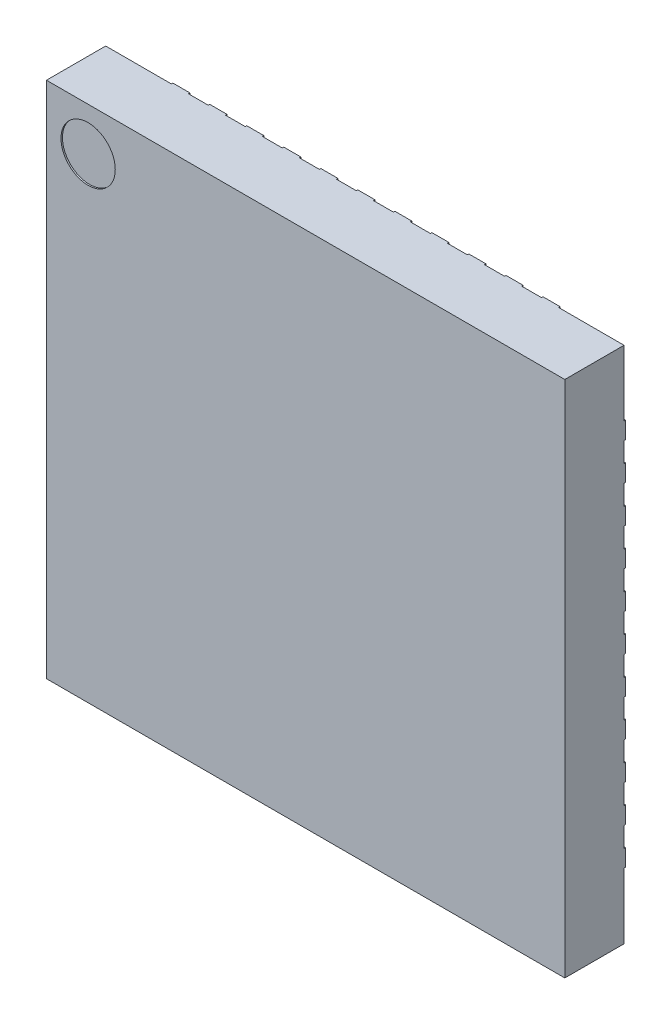
from build123d import *

# Parameters (mm, degrees)
SKETCH1_W                  = 7
SKETCH1_H                  = 7
BOSS_EXTRUDE1_DEPTH        = 0.8
SKETCH2_R                  = 0.36671686
CUT_EXTRUDE1_DEPTH         = 0.02
BOSS_EXTRUDE2_DEPTH        = 0.02
BOSS_EXTRUDE3_DEPTH        = 0.02
LPATTERN1_COUNT            = 6
LPATTERN1_PITCH            = 0.5
LPATTERN1_COUNT_DIR2       = 6
LPATTERN1_PITCH_DIR2       = 0.5
CIRPATTERN1_COPY_1_DEPTH   = 0.02
CIRPATTERN1_COPY_2_DEPTH   = 0.02
CIRPATTERN1_COPY_3_DEPTH   = 0.02
CIRPATTERN1_COPY_4_DEPTH   = 0.02
CIRPATTERN1_COPY_5_DEPTH   = 0.02
CIRPATTERN1_COPY_6_DEPTH   = 0.02
CIRPATTERN1_COPY_7_DEPTH   = 0.02
CIRPATTERN1_COPY_8_DEPTH   = 0.02
CIRPATTERN1_COPY_9_DEPTH   = 0.02
CIRPATTERN1_COPY_10_DEPTH  = 0.02
CIRPATTERN1_COPY_11_DEPTH  = 0.02
CIRPATTERN1_COPY_12_DEPTH  = 0.02
CIRPATTERN1_COPY_13_DEPTH  = 0.02
CIRPATTERN1_COPY_14_DEPTH  = 0.02
CIRPATTERN1_COPY_15_DEPTH  = 0.02
CIRPATTERN1_COPY_16_DEPTH  = 0.02
CIRPATTERN1_COPY_17_DEPTH  = 0.02
CIRPATTERN1_COPY_18_DEPTH  = 0.02
CIRPATTERN1_COPY_19_DEPTH  = 0.02
CIRPATTERN1_COPY_20_DEPTH  = 0.02
CIRPATTERN1_COPY_21_DEPTH  = 0.02
CIRPATTERN1_COPY_22_DEPTH  = 0.02
CIRPATTERN1_COPY_23_DEPTH  = 0.02
CIRPATTERN1_COPY_24_DEPTH  = 0.02
CIRPATTERN1_COPY_25_DEPTH  = 0.02
CIRPATTERN1_COPY_26_DEPTH  = 0.02
CIRPATTERN1_COPY_27_DEPTH  = 0.02
CIRPATTERN1_COPY_28_DEPTH  = 0.02
CIRPATTERN1_COPY_29_DEPTH  = 0.02
CIRPATTERN1_COPY_30_DEPTH  = 0.02
CIRPATTERN1_COPY_31_DEPTH  = 0.02
CIRPATTERN1_COPY_32_DEPTH  = 0.02
CIRPATTERN1_COPY_33_DEPTH  = 0.02
CIRPATTERN1_COPY_34_DEPTH  = 0.02
CIRPATTERN1_COPY_35_DEPTH  = 0.02
CIRPATTERN1_COPY_36_DEPTH  = 0.02
CIRPATTERN1_COPY_37_DEPTH  = 0.02
CIRPATTERN1_COPY_38_DEPTH  = 0.02
CIRPATTERN1_COPY_39_DEPTH  = 0.02
CIRPATTERN1_COPY_40_DEPTH  = 0.02
CIRPATTERN1_COPY_41_DEPTH  = 0.02
CIRPATTERN1_COPY_42_DEPTH  = 0.02
CIRPATTERN1_COPY_43_DEPTH  = 0.02
CIRPATTERN1_COPY_44_DEPTH  = 0.02
CIRPATTERN1_COPY_45_DEPTH  = 0.02
CIRPATTERN1_COPY_46_DEPTH  = 0.02
CIRPATTERN1_COPY_47_DEPTH  = 0.02
CIRPATTERN1_COPY_48_DEPTH  = 0.02
CIRPATTERN1_COPY_49_DEPTH  = 0.02
CIRPATTERN1_COPY_50_DEPTH  = 0.02
CIRPATTERN1_COPY_51_DEPTH  = 0.02
CIRPATTERN1_COPY_52_DEPTH  = 0.02
CIRPATTERN1_COPY_53_DEPTH  = 0.02
CIRPATTERN1_COPY_54_DEPTH  = 0.02
CIRPATTERN1_COPY_55_DEPTH  = 0.02
CIRPATTERN1_COPY_56_DEPTH  = 0.02
CIRPATTERN1_COPY_57_DEPTH  = 0.02
CIRPATTERN1_COPY_58_DEPTH  = 0.02
CIRPATTERN1_COPY_59_DEPTH  = 0.02
CIRPATTERN1_COPY_60_DEPTH  = 0.02
CIRPATTERN1_COPY_61_DEPTH  = 0.02
CIRPATTERN1_COPY_62_DEPTH  = 0.02
CIRPATTERN1_COPY_63_DEPTH  = 0.02
CIRPATTERN1_COPY_64_DEPTH  = 0.02
CIRPATTERN1_COPY_65_DEPTH  = 0.02
CIRPATTERN1_COPY_66_DEPTH  = 0.02
CIRPATTERN1_COPY_67_DEPTH  = 0.02
CIRPATTERN1_COPY_68_DEPTH  = 0.02
CIRPATTERN1_COPY_69_DEPTH  = 0.02
CIRPATTERN1_COPY_70_DEPTH  = 0.02
CIRPATTERN1_COPY_71_DEPTH  = 0.02
CIRPATTERN1_COPY_72_DEPTH  = 0.02
CIRPATTERN1_COPY_73_DEPTH  = 0.02
CIRPATTERN1_COPY_74_DEPTH  = 0.02
CIRPATTERN1_COPY_75_DEPTH  = 0.02
CIRPATTERN1_COPY_76_DEPTH  = 0.02
CIRPATTERN1_COPY_77_DEPTH  = 0.02
CIRPATTERN1_COPY_78_DEPTH  = 0.02
CIRPATTERN1_COPY_79_DEPTH  = 0.02
CIRPATTERN1_COPY_80_DEPTH  = 0.02
CIRPATTERN1_COPY_81_DEPTH  = 0.02
CIRPATTERN1_COPY_82_DEPTH  = 0.02
CIRPATTERN1_COPY_83_DEPTH  = 0.02
CIRPATTERN1_COPY_84_DEPTH  = 0.02
CIRPATTERN1_COPY_85_DEPTH  = 0.02
CIRPATTERN1_COPY_86_DEPTH  = 0.02
CIRPATTERN1_COPY_87_DEPTH  = 0.02
CIRPATTERN1_COPY_88_DEPTH  = 0.02
CIRPATTERN1_COPY_89_DEPTH  = 0.02
CIRPATTERN1_COPY_90_DEPTH  = 0.02
CIRPATTERN1_COPY_91_DEPTH  = 0.02
CIRPATTERN1_COPY_92_DEPTH  = 0.02
CIRPATTERN1_COPY_93_DEPTH  = 0.02
CIRPATTERN1_COPY_94_DEPTH  = 0.02
CIRPATTERN1_COPY_95_DEPTH  = 0.02
CIRPATTERN1_COPY_96_DEPTH  = 0.02
CIRPATTERN1_COPY_97_DEPTH  = 0.02
CIRPATTERN1_COPY_98_DEPTH  = 0.02
CIRPATTERN1_COPY_99_DEPTH  = 0.02
CIRPATTERN1_COPY_100_DEPTH = 0.02
CIRPATTERN1_COPY_101_DEPTH = 0.02
CIRPATTERN1_COPY_102_DEPTH = 0.02
CIRPATTERN1_COPY_103_DEPTH = 0.02
CIRPATTERN1_COPY_104_DEPTH = 0.02
CIRPATTERN1_COPY_105_DEPTH = 0.02
CIRPATTERN1_COPY_106_DEPTH = 0.02
CIRPATTERN1_COPY_107_DEPTH = 0.02
CIRPATTERN1_COPY_108_DEPTH = 0.02


with BuildPart() as part:
    # Sketch1 → Boss-Extrude1 (new body)
    with BuildSketch(Plane.XY):
        Rectangle(SKETCH1_W, SKETCH1_H)
    extrude(amount=BOSS_EXTRUDE1_DEPTH)

    # Sketch2 → Cut-Extrude1 (cut)
    with BuildSketch(Plane.XY.offset(0.8)):
        with Locations((-2.937594595, 2.918449785)):
            Circle(SKETCH2_R)
    extrude(amount=-CUT_EXTRUDE1_DEPTH, mode=Mode.SUBTRACT)

    # Sketch3 → Boss-Extrude2 (add)
    with BuildSketch(Plane(origin=(0, 0, 0), x_dir=(-1, 0, 0), z_dir=(0, 0, -1))):
        Polygon((2, 2.7), (2.7, 2), (2.7, -2.7), (-2.7, -2.7), (-2.7, 2.7), align=None)
    extrude(amount=BOSS_EXTRUDE2_DEPTH)

    # Sketch4 → Boss-Extrude3 (add)
    with BuildSketch(Plane(origin=(0, 0, 0), x_dir=(-1, 0, 0), z_dir=(0, 0, -1))):
        with BuildLine():
            Line((0.115, 3.5), (0.115, 3.115))
            ThreePointArc((0.115, 3.115), (0, 3), (-0.115, 3.115))
            Line((-0.115, 3.115), (-0.115, 3.5))
            Line((-0.115, 3.5), (0, 3.5))
            Line((0, 3.5), (0.115, 3.5))
        make_face()
    boss_extrude3 = extrude(amount=BOSS_EXTRUDE3_DEPTH)

    # LPattern1: Boss-Extrude3 6 × 6
    with Locations(*[Vector(-1, 0, 0) * (i * LPATTERN1_PITCH) + Vector(1, 0, 0) * (j * LPATTERN1_PITCH_DIR2) for i in range(LPATTERN1_COUNT) for j in range(LPATTERN1_COUNT_DIR2) if (i, j) != (0, 0)]):
        add(boss_extrude3)

    # CirPattern1 copy 1 sketch → CirPattern1 copy 1 (add)
    with BuildSketch(Plane(origin=(0, -0.5, 0), x_dir=(0, 1, 0), z_dir=(0, 0, -1))):
        with BuildLine():
            Line((0.115, 3.5), (0.115, 3.115))
            ThreePointArc((0.115, 3.115), (0, 3), (-0.115, 3.115))
            Line((-0.115, 3.115), (-0.115, 3.5))
            Line((-0.115, 3.5), (0, 3.5))
            Line((0, 3.5), (0.115, 3.5))
        make_face()
    extrude(amount=CIRPATTERN1_COPY_1_DEPTH)

    # CirPattern1 copy 2 sketch → CirPattern1 copy 2 (add)
    with BuildSketch(Plane(origin=(-0.5, 0, 0), x_dir=(1, 0, 0), z_dir=(0, 0, -1))):
        with BuildLine():
            Line((0.115, 3.5), (0.115, 3.115))
            ThreePointArc((0.115, 3.115), (0, 3), (-0.115, 3.115))
            Line((-0.115, 3.115), (-0.115, 3.5))
            Line((-0.115, 3.5), (0, 3.5))
            Line((0, 3.5), (0.115, 3.5))
        make_face()
    extrude(amount=CIRPATTERN1_COPY_2_DEPTH)

    # CirPattern1 copy 3 sketch → CirPattern1 copy 3 (add)
    with BuildSketch(Plane(origin=(0, 0.5, 0), x_dir=(0, -1, 0), z_dir=(0, 0, -1))):
        with BuildLine():
            Line((0.115, 3.5), (0.115, 3.115))
            ThreePointArc((0.115, 3.115), (0, 3), (-0.115, 3.115))
            Line((-0.115, 3.115), (-0.115, 3.5))
            Line((-0.115, 3.5), (0, 3.5))
            Line((0, 3.5), (0.115, 3.5))
        make_face()
    extrude(amount=CIRPATTERN1_COPY_3_DEPTH)

    # CirPattern1 copy 4 sketch → CirPattern1 copy 4 (add)
    with BuildSketch(Plane(origin=(0, -1, 0), x_dir=(0, 1, 0), z_dir=(0, 0, -1))):
        with BuildLine():
            Line((0.115, 3.5), (0.115, 3.115))
            ThreePointArc((0.115, 3.115), (0, 3), (-0.115, 3.115))
            Line((-0.115, 3.115), (-0.115, 3.5))
            Line((-0.115, 3.5), (0, 3.5))
            Line((0, 3.5), (0.115, 3.5))
        make_face()
    extrude(amount=CIRPATTERN1_COPY_4_DEPTH)

    # CirPattern1 copy 5 sketch → CirPattern1 copy 5 (add)
    with BuildSketch(Plane(origin=(-1, 0, 0), x_dir=(1, 0, 0), z_dir=(0, 0, -1))):
        with BuildLine():
            Line((0.115, 3.5), (0.115, 3.115))
            ThreePointArc((0.115, 3.115), (0, 3), (-0.115, 3.115))
            Line((-0.115, 3.115), (-0.115, 3.5))
            Line((-0.115, 3.5), (0, 3.5))
            Line((0, 3.5), (0.115, 3.5))
        make_face()
    extrude(amount=CIRPATTERN1_COPY_5_DEPTH)

    # CirPattern1 copy 6 sketch → CirPattern1 copy 6 (add)
    with BuildSketch(Plane(origin=(0, 1, 0), x_dir=(0, -1, 0), z_dir=(0, 0, -1))):
        with BuildLine():
            Line((0.115, 3.5), (0.115, 3.115))
            ThreePointArc((0.115, 3.115), (0, 3), (-0.115, 3.115))
            Line((-0.115, 3.115), (-0.115, 3.5))
            Line((-0.115, 3.5), (0, 3.5))
            Line((0, 3.5), (0.115, 3.5))
        make_face()
    extrude(amount=CIRPATTERN1_COPY_6_DEPTH)

    # CirPattern1 copy 7 sketch → CirPattern1 copy 7 (add)
    with BuildSketch(Plane(origin=(0, -1.5, 0), x_dir=(0, 1, 0), z_dir=(0, 0, -1))):
        with BuildLine():
            Line((0.115, 3.5), (0.115, 3.115))
            ThreePointArc((0.115, 3.115), (0, 3), (-0.115, 3.115))
            Line((-0.115, 3.115), (-0.115, 3.5))
            Line((-0.115, 3.5), (0, 3.5))
            Line((0, 3.5), (0.115, 3.5))
        make_face()
    extrude(amount=CIRPATTERN1_COPY_7_DEPTH)

    # CirPattern1 copy 8 sketch → CirPattern1 copy 8 (add)
    with BuildSketch(Plane(origin=(-1.5, 0, 0), x_dir=(1, 0, 0), z_dir=(0, 0, -1))):
        with BuildLine():
            Line((0.115, 3.5), (0.115, 3.115))
            ThreePointArc((0.115, 3.115), (0, 3), (-0.115, 3.115))
            Line((-0.115, 3.115), (-0.115, 3.5))
            Line((-0.115, 3.5), (0, 3.5))
            Line((0, 3.5), (0.115, 3.5))
        make_face()
    extrude(amount=CIRPATTERN1_COPY_8_DEPTH)

    # CirPattern1 copy 9 sketch → CirPattern1 copy 9 (add)
    with BuildSketch(Plane(origin=(0, 1.5, 0), x_dir=(0, -1, 0), z_dir=(0, 0, -1))):
        with BuildLine():
            Line((0.115, 3.5), (0.115, 3.115))
            ThreePointArc((0.115, 3.115), (0, 3), (-0.115, 3.115))
            Line((-0.115, 3.115), (-0.115, 3.5))
            Line((-0.115, 3.5), (0, 3.5))
            Line((0, 3.5), (0.115, 3.5))
        make_face()
    extrude(amount=CIRPATTERN1_COPY_9_DEPTH)

    # CirPattern1 copy 10 sketch → CirPattern1 copy 10 (add)
    with BuildSketch(Plane(origin=(0, -2, 0), x_dir=(0, 1, 0), z_dir=(0, 0, -1))):
        with BuildLine():
            Line((0.115, 3.5), (0.115, 3.115))
            ThreePointArc((0.115, 3.115), (0, 3), (-0.115, 3.115))
            Line((-0.115, 3.115), (-0.115, 3.5))
            Line((-0.115, 3.5), (0, 3.5))
            Line((0, 3.5), (0.115, 3.5))
        make_face()
    extrude(amount=CIRPATTERN1_COPY_10_DEPTH)

    # CirPattern1 copy 11 sketch → CirPattern1 copy 11 (add)
    with BuildSketch(Plane(origin=(-2, 0, 0), x_dir=(1, 0, 0), z_dir=(0, 0, -1))):
        with BuildLine():
            Line((0.115, 3.5), (0.115, 3.115))
            ThreePointArc((0.115, 3.115), (0, 3), (-0.115, 3.115))
            Line((-0.115, 3.115), (-0.115, 3.5))
            Line((-0.115, 3.5), (0, 3.5))
            Line((0, 3.5), (0.115, 3.5))
        make_face()
    extrude(amount=CIRPATTERN1_COPY_11_DEPTH)

    # CirPattern1 copy 12 sketch → CirPattern1 copy 12 (add)
    with BuildSketch(Plane(origin=(0, 2, 0), x_dir=(0, -1, 0), z_dir=(0, 0, -1))):
        with BuildLine():
            Line((0.115, 3.5), (0.115, 3.115))
            ThreePointArc((0.115, 3.115), (0, 3), (-0.115, 3.115))
            Line((-0.115, 3.115), (-0.115, 3.5))
            Line((-0.115, 3.5), (0, 3.5))
            Line((0, 3.5), (0.115, 3.5))
        make_face()
    extrude(amount=CIRPATTERN1_COPY_12_DEPTH)

    # CirPattern1 copy 13 sketch → CirPattern1 copy 13 (add)
    with BuildSketch(Plane(origin=(0, -2.5, 0), x_dir=(0, 1, 0), z_dir=(0, 0, -1))):
        with BuildLine():
            Line((0.115, 3.5), (0.115, 3.115))
            ThreePointArc((0.115, 3.115), (0, 3), (-0.115, 3.115))
            Line((-0.115, 3.115), (-0.115, 3.5))
            Line((-0.115, 3.5), (0, 3.5))
            Line((0, 3.5), (0.115, 3.5))
        make_face()
    extrude(amount=CIRPATTERN1_COPY_13_DEPTH)

    # CirPattern1 copy 14 sketch → CirPattern1 copy 14 (add)
    with BuildSketch(Plane(origin=(-2.5, 0, 0), x_dir=(1, 0, 0), z_dir=(0, 0, -1))):
        with BuildLine():
            Line((0.115, 3.5), (0.115, 3.115))
            ThreePointArc((0.115, 3.115), (0, 3), (-0.115, 3.115))
            Line((-0.115, 3.115), (-0.115, 3.5))
            Line((-0.115, 3.5), (0, 3.5))
            Line((0, 3.5), (0.115, 3.5))
        make_face()
    extrude(amount=CIRPATTERN1_COPY_14_DEPTH)

    # CirPattern1 copy 15 sketch → CirPattern1 copy 15 (add)
    with BuildSketch(Plane(origin=(0, 2.5, 0), x_dir=(0, -1, 0), z_dir=(0, 0, -1))):
        with BuildLine():
            Line((0.115, 3.5), (0.115, 3.115))
            ThreePointArc((0.115, 3.115), (0, 3), (-0.115, 3.115))
            Line((-0.115, 3.115), (-0.115, 3.5))
            Line((-0.115, 3.5), (0, 3.5))
            Line((0, 3.5), (0.115, 3.5))
        make_face()
    extrude(amount=CIRPATTERN1_COPY_15_DEPTH)

    # CirPattern1 copy 16 sketch → CirPattern1 copy 16 (add)
    with BuildSketch(Plane(origin=(0, 0.5, 0), x_dir=(0, 1, 0), z_dir=(0, 0, -1))):
        with BuildLine():
            Line((0.115, 3.5), (0.115, 3.115))
            ThreePointArc((0.115, 3.115), (0, 3), (-0.115, 3.115))
            Line((-0.115, 3.115), (-0.115, 3.5))
            Line((-0.115, 3.5), (0, 3.5))
            Line((0, 3.5), (0.115, 3.5))
        make_face()
    extrude(amount=CIRPATTERN1_COPY_16_DEPTH)

    # CirPattern1 copy 17 sketch → CirPattern1 copy 17 (add)
    with BuildSketch(Plane(origin=(0.5, 0, 0), x_dir=(1, 0, 0), z_dir=(0, 0, -1))):
        with BuildLine():
            Line((0.115, 3.5), (0.115, 3.115))
            ThreePointArc((0.115, 3.115), (0, 3), (-0.115, 3.115))
            Line((-0.115, 3.115), (-0.115, 3.5))
            Line((-0.115, 3.5), (0, 3.5))
            Line((0, 3.5), (0.115, 3.5))
        make_face()
    extrude(amount=CIRPATTERN1_COPY_17_DEPTH)

    # CirPattern1 copy 18 sketch → CirPattern1 copy 18 (add)
    with BuildSketch(Plane(origin=(0, -0.5, 0), x_dir=(0, -1, 0), z_dir=(0, 0, -1))):
        with BuildLine():
            Line((0.115, 3.5), (0.115, 3.115))
            ThreePointArc((0.115, 3.115), (0, 3), (-0.115, 3.115))
            Line((-0.115, 3.115), (-0.115, 3.5))
            Line((-0.115, 3.5), (0, 3.5))
            Line((0, 3.5), (0.115, 3.5))
        make_face()
    extrude(amount=CIRPATTERN1_COPY_18_DEPTH)

    # CirPattern1 copy 19 sketch → CirPattern1 copy 19 (add)
    with BuildSketch(Plane.YX):
        with BuildLine():
            Line((0.115, 3.5), (0.115, 3.115))
            ThreePointArc((0.115, 3.115), (0, 3), (-0.115, 3.115))
            Line((-0.115, 3.115), (-0.115, 3.5))
            Line((-0.115, 3.5), (0, 3.5))
            Line((0, 3.5), (0.115, 3.5))
        make_face()
    extrude(amount=CIRPATTERN1_COPY_19_DEPTH)

    # CirPattern1 copy 20 sketch → CirPattern1 copy 20 (add)
    with BuildSketch(Plane(origin=(0, 0, 0), x_dir=(1, 0, 0), z_dir=(0, 0, -1))):
        with BuildLine():
            Line((0.115, 3.5), (0.115, 3.115))
            ThreePointArc((0.115, 3.115), (0, 3), (-0.115, 3.115))
            Line((-0.115, 3.115), (-0.115, 3.5))
            Line((-0.115, 3.5), (0, 3.5))
            Line((0, 3.5), (0.115, 3.5))
        make_face()
    extrude(amount=CIRPATTERN1_COPY_20_DEPTH)

    # CirPattern1 copy 21 sketch → CirPattern1 copy 21 (add)
    with BuildSketch(Plane(origin=(0, 0, 0), x_dir=(0, -1, 0), z_dir=(0, 0, -1))):
        with BuildLine():
            Line((0.115, 3.5), (0.115, 3.115))
            ThreePointArc((0.115, 3.115), (0, 3), (-0.115, 3.115))
            Line((-0.115, 3.115), (-0.115, 3.5))
            Line((-0.115, 3.5), (0, 3.5))
            Line((0, 3.5), (0.115, 3.5))
        make_face()
    extrude(amount=CIRPATTERN1_COPY_21_DEPTH)

    # CirPattern1 copy 22 sketch → CirPattern1 copy 22 (add)
    with BuildSketch(Plane(origin=(0, -0.5, 0), x_dir=(0, 1, 0), z_dir=(0, 0, -1))):
        with BuildLine():
            Line((0.115, 3.5), (0.115, 3.115))
            ThreePointArc((0.115, 3.115), (0, 3), (-0.115, 3.115))
            Line((-0.115, 3.115), (-0.115, 3.5))
            Line((-0.115, 3.5), (0, 3.5))
            Line((0, 3.5), (0.115, 3.5))
        make_face()
    extrude(amount=CIRPATTERN1_COPY_22_DEPTH)

    # CirPattern1 copy 23 sketch → CirPattern1 copy 23 (add)
    with BuildSketch(Plane(origin=(-0.5, 0, 0), x_dir=(1, 0, 0), z_dir=(0, 0, -1))):
        with BuildLine():
            Line((0.115, 3.5), (0.115, 3.115))
            ThreePointArc((0.115, 3.115), (0, 3), (-0.115, 3.115))
            Line((-0.115, 3.115), (-0.115, 3.5))
            Line((-0.115, 3.5), (0, 3.5))
            Line((0, 3.5), (0.115, 3.5))
        make_face()
    extrude(amount=CIRPATTERN1_COPY_23_DEPTH)

    # CirPattern1 copy 24 sketch → CirPattern1 copy 24 (add)
    with BuildSketch(Plane(origin=(0, 0.5, 0), x_dir=(0, -1, 0), z_dir=(0, 0, -1))):
        with BuildLine():
            Line((0.115, 3.5), (0.115, 3.115))
            ThreePointArc((0.115, 3.115), (0, 3), (-0.115, 3.115))
            Line((-0.115, 3.115), (-0.115, 3.5))
            Line((-0.115, 3.5), (0, 3.5))
            Line((0, 3.5), (0.115, 3.5))
        make_face()
    extrude(amount=CIRPATTERN1_COPY_24_DEPTH)

    # CirPattern1 copy 25 sketch → CirPattern1 copy 25 (add)
    with BuildSketch(Plane(origin=(0, -1, 0), x_dir=(0, 1, 0), z_dir=(0, 0, -1))):
        with BuildLine():
            Line((0.115, 3.5), (0.115, 3.115))
            ThreePointArc((0.115, 3.115), (0, 3), (-0.115, 3.115))
            Line((-0.115, 3.115), (-0.115, 3.5))
            Line((-0.115, 3.5), (0, 3.5))
            Line((0, 3.5), (0.115, 3.5))
        make_face()
    extrude(amount=CIRPATTERN1_COPY_25_DEPTH)

    # CirPattern1 copy 26 sketch → CirPattern1 copy 26 (add)
    with BuildSketch(Plane(origin=(-1, 0, 0), x_dir=(1, 0, 0), z_dir=(0, 0, -1))):
        with BuildLine():
            Line((0.115, 3.5), (0.115, 3.115))
            ThreePointArc((0.115, 3.115), (0, 3), (-0.115, 3.115))
            Line((-0.115, 3.115), (-0.115, 3.5))
            Line((-0.115, 3.5), (0, 3.5))
            Line((0, 3.5), (0.115, 3.5))
        make_face()
    extrude(amount=CIRPATTERN1_COPY_26_DEPTH)

    # CirPattern1 copy 27 sketch → CirPattern1 copy 27 (add)
    with BuildSketch(Plane(origin=(0, 1, 0), x_dir=(0, -1, 0), z_dir=(0, 0, -1))):
        with BuildLine():
            Line((0.115, 3.5), (0.115, 3.115))
            ThreePointArc((0.115, 3.115), (0, 3), (-0.115, 3.115))
            Line((-0.115, 3.115), (-0.115, 3.5))
            Line((-0.115, 3.5), (0, 3.5))
            Line((0, 3.5), (0.115, 3.5))
        make_face()
    extrude(amount=CIRPATTERN1_COPY_27_DEPTH)

    # CirPattern1 copy 28 sketch → CirPattern1 copy 28 (add)
    with BuildSketch(Plane(origin=(0, -1.5, 0), x_dir=(0, 1, 0), z_dir=(0, 0, -1))):
        with BuildLine():
            Line((0.115, 3.5), (0.115, 3.115))
            ThreePointArc((0.115, 3.115), (0, 3), (-0.115, 3.115))
            Line((-0.115, 3.115), (-0.115, 3.5))
            Line((-0.115, 3.5), (0, 3.5))
            Line((0, 3.5), (0.115, 3.5))
        make_face()
    extrude(amount=CIRPATTERN1_COPY_28_DEPTH)

    # CirPattern1 copy 29 sketch → CirPattern1 copy 29 (add)
    with BuildSketch(Plane(origin=(-1.5, 0, 0), x_dir=(1, 0, 0), z_dir=(0, 0, -1))):
        with BuildLine():
            Line((0.115, 3.5), (0.115, 3.115))
            ThreePointArc((0.115, 3.115), (0, 3), (-0.115, 3.115))
            Line((-0.115, 3.115), (-0.115, 3.5))
            Line((-0.115, 3.5), (0, 3.5))
            Line((0, 3.5), (0.115, 3.5))
        make_face()
    extrude(amount=CIRPATTERN1_COPY_29_DEPTH)

    # CirPattern1 copy 30 sketch → CirPattern1 copy 30 (add)
    with BuildSketch(Plane(origin=(0, 1.5, 0), x_dir=(0, -1, 0), z_dir=(0, 0, -1))):
        with BuildLine():
            Line((0.115, 3.5), (0.115, 3.115))
            ThreePointArc((0.115, 3.115), (0, 3), (-0.115, 3.115))
            Line((-0.115, 3.115), (-0.115, 3.5))
            Line((-0.115, 3.5), (0, 3.5))
            Line((0, 3.5), (0.115, 3.5))
        make_face()
    extrude(amount=CIRPATTERN1_COPY_30_DEPTH)

    # CirPattern1 copy 31 sketch → CirPattern1 copy 31 (add)
    with BuildSketch(Plane(origin=(0, -2, 0), x_dir=(0, 1, 0), z_dir=(0, 0, -1))):
        with BuildLine():
            Line((0.115, 3.5), (0.115, 3.115))
            ThreePointArc((0.115, 3.115), (0, 3), (-0.115, 3.115))
            Line((-0.115, 3.115), (-0.115, 3.5))
            Line((-0.115, 3.5), (0, 3.5))
            Line((0, 3.5), (0.115, 3.5))
        make_face()
    extrude(amount=CIRPATTERN1_COPY_31_DEPTH)

    # CirPattern1 copy 32 sketch → CirPattern1 copy 32 (add)
    with BuildSketch(Plane(origin=(-2, 0, 0), x_dir=(1, 0, 0), z_dir=(0, 0, -1))):
        with BuildLine():
            Line((0.115, 3.5), (0.115, 3.115))
            ThreePointArc((0.115, 3.115), (0, 3), (-0.115, 3.115))
            Line((-0.115, 3.115), (-0.115, 3.5))
            Line((-0.115, 3.5), (0, 3.5))
            Line((0, 3.5), (0.115, 3.5))
        make_face()
    extrude(amount=CIRPATTERN1_COPY_32_DEPTH)

    # CirPattern1 copy 33 sketch → CirPattern1 copy 33 (add)
    with BuildSketch(Plane(origin=(0, 2, 0), x_dir=(0, -1, 0), z_dir=(0, 0, -1))):
        with BuildLine():
            Line((0.115, 3.5), (0.115, 3.115))
            ThreePointArc((0.115, 3.115), (0, 3), (-0.115, 3.115))
            Line((-0.115, 3.115), (-0.115, 3.5))
            Line((-0.115, 3.5), (0, 3.5))
            Line((0, 3.5), (0.115, 3.5))
        make_face()
    extrude(amount=CIRPATTERN1_COPY_33_DEPTH)

    # CirPattern1 copy 34 sketch → CirPattern1 copy 34 (add)
    with BuildSketch(Plane(origin=(0, 1, 0), x_dir=(0, 1, 0), z_dir=(0, 0, -1))):
        with BuildLine():
            Line((0.115, 3.5), (0.115, 3.115))
            ThreePointArc((0.115, 3.115), (0, 3), (-0.115, 3.115))
            Line((-0.115, 3.115), (-0.115, 3.5))
            Line((-0.115, 3.5), (0, 3.5))
            Line((0, 3.5), (0.115, 3.5))
        make_face()
    extrude(amount=CIRPATTERN1_COPY_34_DEPTH)

    # CirPattern1 copy 35 sketch → CirPattern1 copy 35 (add)
    with BuildSketch(Plane(origin=(1, 0, 0), x_dir=(1, 0, 0), z_dir=(0, 0, -1))):
        with BuildLine():
            Line((0.115, 3.5), (0.115, 3.115))
            ThreePointArc((0.115, 3.115), (0, 3), (-0.115, 3.115))
            Line((-0.115, 3.115), (-0.115, 3.5))
            Line((-0.115, 3.5), (0, 3.5))
            Line((0, 3.5), (0.115, 3.5))
        make_face()
    extrude(amount=CIRPATTERN1_COPY_35_DEPTH)

    # CirPattern1 copy 36 sketch → CirPattern1 copy 36 (add)
    with BuildSketch(Plane(origin=(0, -1, 0), x_dir=(0, -1, 0), z_dir=(0, 0, -1))):
        with BuildLine():
            Line((0.115, 3.5), (0.115, 3.115))
            ThreePointArc((0.115, 3.115), (0, 3), (-0.115, 3.115))
            Line((-0.115, 3.115), (-0.115, 3.5))
            Line((-0.115, 3.5), (0, 3.5))
            Line((0, 3.5), (0.115, 3.5))
        make_face()
    extrude(amount=CIRPATTERN1_COPY_36_DEPTH)

    # CirPattern1 copy 37 sketch → CirPattern1 copy 37 (add)
    with BuildSketch(Plane(origin=(0, 0.5, 0), x_dir=(0, 1, 0), z_dir=(0, 0, -1))):
        with BuildLine():
            Line((0.115, 3.5), (0.115, 3.115))
            ThreePointArc((0.115, 3.115), (0, 3), (-0.115, 3.115))
            Line((-0.115, 3.115), (-0.115, 3.5))
            Line((-0.115, 3.5), (0, 3.5))
            Line((0, 3.5), (0.115, 3.5))
        make_face()
    extrude(amount=CIRPATTERN1_COPY_37_DEPTH)

    # CirPattern1 copy 38 sketch → CirPattern1 copy 38 (add)
    with BuildSketch(Plane(origin=(0.5, 0, 0), x_dir=(1, 0, 0), z_dir=(0, 0, -1))):
        with BuildLine():
            Line((0.115, 3.5), (0.115, 3.115))
            ThreePointArc((0.115, 3.115), (0, 3), (-0.115, 3.115))
            Line((-0.115, 3.115), (-0.115, 3.5))
            Line((-0.115, 3.5), (0, 3.5))
            Line((0, 3.5), (0.115, 3.5))
        make_face()
    extrude(amount=CIRPATTERN1_COPY_38_DEPTH)

    # CirPattern1 copy 39 sketch → CirPattern1 copy 39 (add)
    with BuildSketch(Plane(origin=(0, -0.5, 0), x_dir=(0, -1, 0), z_dir=(0, 0, -1))):
        with BuildLine():
            Line((0.115, 3.5), (0.115, 3.115))
            ThreePointArc((0.115, 3.115), (0, 3), (-0.115, 3.115))
            Line((-0.115, 3.115), (-0.115, 3.5))
            Line((-0.115, 3.5), (0, 3.5))
            Line((0, 3.5), (0.115, 3.5))
        make_face()
    extrude(amount=CIRPATTERN1_COPY_39_DEPTH)

    # CirPattern1 copy 40 sketch → CirPattern1 copy 40 (add)
    with BuildSketch(Plane.YX):
        with BuildLine():
            Line((0.115, 3.5), (0.115, 3.115))
            ThreePointArc((0.115, 3.115), (0, 3), (-0.115, 3.115))
            Line((-0.115, 3.115), (-0.115, 3.5))
            Line((-0.115, 3.5), (0, 3.5))
            Line((0, 3.5), (0.115, 3.5))
        make_face()
    extrude(amount=CIRPATTERN1_COPY_40_DEPTH)

    # CirPattern1 copy 41 sketch → CirPattern1 copy 41 (add)
    with BuildSketch(Plane(origin=(0, 0, 0), x_dir=(1, 0, 0), z_dir=(0, 0, -1))):
        with BuildLine():
            Line((0.115, 3.5), (0.115, 3.115))
            ThreePointArc((0.115, 3.115), (0, 3), (-0.115, 3.115))
            Line((-0.115, 3.115), (-0.115, 3.5))
            Line((-0.115, 3.5), (0, 3.5))
            Line((0, 3.5), (0.115, 3.5))
        make_face()
    extrude(amount=CIRPATTERN1_COPY_41_DEPTH)

    # CirPattern1 copy 42 sketch → CirPattern1 copy 42 (add)
    with BuildSketch(Plane(origin=(0, 0, 0), x_dir=(0, -1, 0), z_dir=(0, 0, -1))):
        with BuildLine():
            Line((0.115, 3.5), (0.115, 3.115))
            ThreePointArc((0.115, 3.115), (0, 3), (-0.115, 3.115))
            Line((-0.115, 3.115), (-0.115, 3.5))
            Line((-0.115, 3.5), (0, 3.5))
            Line((0, 3.5), (0.115, 3.5))
        make_face()
    extrude(amount=CIRPATTERN1_COPY_42_DEPTH)

    # CirPattern1 copy 43 sketch → CirPattern1 copy 43 (add)
    with BuildSketch(Plane(origin=(0, -0.5, 0), x_dir=(0, 1, 0), z_dir=(0, 0, -1))):
        with BuildLine():
            Line((0.115, 3.5), (0.115, 3.115))
            ThreePointArc((0.115, 3.115), (0, 3), (-0.115, 3.115))
            Line((-0.115, 3.115), (-0.115, 3.5))
            Line((-0.115, 3.5), (0, 3.5))
            Line((0, 3.5), (0.115, 3.5))
        make_face()
    extrude(amount=CIRPATTERN1_COPY_43_DEPTH)

    # CirPattern1 copy 44 sketch → CirPattern1 copy 44 (add)
    with BuildSketch(Plane(origin=(-0.5, 0, 0), x_dir=(1, 0, 0), z_dir=(0, 0, -1))):
        with BuildLine():
            Line((0.115, 3.5), (0.115, 3.115))
            ThreePointArc((0.115, 3.115), (0, 3), (-0.115, 3.115))
            Line((-0.115, 3.115), (-0.115, 3.5))
            Line((-0.115, 3.5), (0, 3.5))
            Line((0, 3.5), (0.115, 3.5))
        make_face()
    extrude(amount=CIRPATTERN1_COPY_44_DEPTH)

    # CirPattern1 copy 45 sketch → CirPattern1 copy 45 (add)
    with BuildSketch(Plane(origin=(0, 0.5, 0), x_dir=(0, -1, 0), z_dir=(0, 0, -1))):
        with BuildLine():
            Line((0.115, 3.5), (0.115, 3.115))
            ThreePointArc((0.115, 3.115), (0, 3), (-0.115, 3.115))
            Line((-0.115, 3.115), (-0.115, 3.5))
            Line((-0.115, 3.5), (0, 3.5))
            Line((0, 3.5), (0.115, 3.5))
        make_face()
    extrude(amount=CIRPATTERN1_COPY_45_DEPTH)

    # CirPattern1 copy 46 sketch → CirPattern1 copy 46 (add)
    with BuildSketch(Plane(origin=(0, -1, 0), x_dir=(0, 1, 0), z_dir=(0, 0, -1))):
        with BuildLine():
            Line((0.115, 3.5), (0.115, 3.115))
            ThreePointArc((0.115, 3.115), (0, 3), (-0.115, 3.115))
            Line((-0.115, 3.115), (-0.115, 3.5))
            Line((-0.115, 3.5), (0, 3.5))
            Line((0, 3.5), (0.115, 3.5))
        make_face()
    extrude(amount=CIRPATTERN1_COPY_46_DEPTH)

    # CirPattern1 copy 47 sketch → CirPattern1 copy 47 (add)
    with BuildSketch(Plane(origin=(-1, 0, 0), x_dir=(1, 0, 0), z_dir=(0, 0, -1))):
        with BuildLine():
            Line((0.115, 3.5), (0.115, 3.115))
            ThreePointArc((0.115, 3.115), (0, 3), (-0.115, 3.115))
            Line((-0.115, 3.115), (-0.115, 3.5))
            Line((-0.115, 3.5), (0, 3.5))
            Line((0, 3.5), (0.115, 3.5))
        make_face()
    extrude(amount=CIRPATTERN1_COPY_47_DEPTH)

    # CirPattern1 copy 48 sketch → CirPattern1 copy 48 (add)
    with BuildSketch(Plane(origin=(0, 1, 0), x_dir=(0, -1, 0), z_dir=(0, 0, -1))):
        with BuildLine():
            Line((0.115, 3.5), (0.115, 3.115))
            ThreePointArc((0.115, 3.115), (0, 3), (-0.115, 3.115))
            Line((-0.115, 3.115), (-0.115, 3.5))
            Line((-0.115, 3.5), (0, 3.5))
            Line((0, 3.5), (0.115, 3.5))
        make_face()
    extrude(amount=CIRPATTERN1_COPY_48_DEPTH)

    # CirPattern1 copy 49 sketch → CirPattern1 copy 49 (add)
    with BuildSketch(Plane(origin=(0, -1.5, 0), x_dir=(0, 1, 0), z_dir=(0, 0, -1))):
        with BuildLine():
            Line((0.115, 3.5), (0.115, 3.115))
            ThreePointArc((0.115, 3.115), (0, 3), (-0.115, 3.115))
            Line((-0.115, 3.115), (-0.115, 3.5))
            Line((-0.115, 3.5), (0, 3.5))
            Line((0, 3.5), (0.115, 3.5))
        make_face()
    extrude(amount=CIRPATTERN1_COPY_49_DEPTH)

    # CirPattern1 copy 50 sketch → CirPattern1 copy 50 (add)
    with BuildSketch(Plane(origin=(-1.5, 0, 0), x_dir=(1, 0, 0), z_dir=(0, 0, -1))):
        with BuildLine():
            Line((0.115, 3.5), (0.115, 3.115))
            ThreePointArc((0.115, 3.115), (0, 3), (-0.115, 3.115))
            Line((-0.115, 3.115), (-0.115, 3.5))
            Line((-0.115, 3.5), (0, 3.5))
            Line((0, 3.5), (0.115, 3.5))
        make_face()
    extrude(amount=CIRPATTERN1_COPY_50_DEPTH)

    # CirPattern1 copy 51 sketch → CirPattern1 copy 51 (add)
    with BuildSketch(Plane(origin=(0, 1.5, 0), x_dir=(0, -1, 0), z_dir=(0, 0, -1))):
        with BuildLine():
            Line((0.115, 3.5), (0.115, 3.115))
            ThreePointArc((0.115, 3.115), (0, 3), (-0.115, 3.115))
            Line((-0.115, 3.115), (-0.115, 3.5))
            Line((-0.115, 3.5), (0, 3.5))
            Line((0, 3.5), (0.115, 3.5))
        make_face()
    extrude(amount=CIRPATTERN1_COPY_51_DEPTH)

    # CirPattern1 copy 52 sketch → CirPattern1 copy 52 (add)
    with BuildSketch(Plane(origin=(0, 1.5, 0), x_dir=(0, 1, 0), z_dir=(0, 0, -1))):
        with BuildLine():
            Line((0.115, 3.5), (0.115, 3.115))
            ThreePointArc((0.115, 3.115), (0, 3), (-0.115, 3.115))
            Line((-0.115, 3.115), (-0.115, 3.5))
            Line((-0.115, 3.5), (0, 3.5))
            Line((0, 3.5), (0.115, 3.5))
        make_face()
    extrude(amount=CIRPATTERN1_COPY_52_DEPTH)

    # CirPattern1 copy 53 sketch → CirPattern1 copy 53 (add)
    with BuildSketch(Plane(origin=(1.5, 0, 0), x_dir=(1, 0, 0), z_dir=(0, 0, -1))):
        with BuildLine():
            Line((0.115, 3.5), (0.115, 3.115))
            ThreePointArc((0.115, 3.115), (0, 3), (-0.115, 3.115))
            Line((-0.115, 3.115), (-0.115, 3.5))
            Line((-0.115, 3.5), (0, 3.5))
            Line((0, 3.5), (0.115, 3.5))
        make_face()
    extrude(amount=CIRPATTERN1_COPY_53_DEPTH)

    # CirPattern1 copy 54 sketch → CirPattern1 copy 54 (add)
    with BuildSketch(Plane(origin=(0, -1.5, 0), x_dir=(0, -1, 0), z_dir=(0, 0, -1))):
        with BuildLine():
            Line((0.115, 3.5), (0.115, 3.115))
            ThreePointArc((0.115, 3.115), (0, 3), (-0.115, 3.115))
            Line((-0.115, 3.115), (-0.115, 3.5))
            Line((-0.115, 3.5), (0, 3.5))
            Line((0, 3.5), (0.115, 3.5))
        make_face()
    extrude(amount=CIRPATTERN1_COPY_54_DEPTH)

    # CirPattern1 copy 55 sketch → CirPattern1 copy 55 (add)
    with BuildSketch(Plane(origin=(0, 1, 0), x_dir=(0, 1, 0), z_dir=(0, 0, -1))):
        with BuildLine():
            Line((0.115, 3.5), (0.115, 3.115))
            ThreePointArc((0.115, 3.115), (0, 3), (-0.115, 3.115))
            Line((-0.115, 3.115), (-0.115, 3.5))
            Line((-0.115, 3.5), (0, 3.5))
            Line((0, 3.5), (0.115, 3.5))
        make_face()
    extrude(amount=CIRPATTERN1_COPY_55_DEPTH)

    # CirPattern1 copy 56 sketch → CirPattern1 copy 56 (add)
    with BuildSketch(Plane(origin=(1, 0, 0), x_dir=(1, 0, 0), z_dir=(0, 0, -1))):
        with BuildLine():
            Line((0.115, 3.5), (0.115, 3.115))
            ThreePointArc((0.115, 3.115), (0, 3), (-0.115, 3.115))
            Line((-0.115, 3.115), (-0.115, 3.5))
            Line((-0.115, 3.5), (0, 3.5))
            Line((0, 3.5), (0.115, 3.5))
        make_face()
    extrude(amount=CIRPATTERN1_COPY_56_DEPTH)

    # CirPattern1 copy 57 sketch → CirPattern1 copy 57 (add)
    with BuildSketch(Plane(origin=(0, -1, 0), x_dir=(0, -1, 0), z_dir=(0, 0, -1))):
        with BuildLine():
            Line((0.115, 3.5), (0.115, 3.115))
            ThreePointArc((0.115, 3.115), (0, 3), (-0.115, 3.115))
            Line((-0.115, 3.115), (-0.115, 3.5))
            Line((-0.115, 3.5), (0, 3.5))
            Line((0, 3.5), (0.115, 3.5))
        make_face()
    extrude(amount=CIRPATTERN1_COPY_57_DEPTH)

    # CirPattern1 copy 58 sketch → CirPattern1 copy 58 (add)
    with BuildSketch(Plane(origin=(0, 0.5, 0), x_dir=(0, 1, 0), z_dir=(0, 0, -1))):
        with BuildLine():
            Line((0.115, 3.5), (0.115, 3.115))
            ThreePointArc((0.115, 3.115), (0, 3), (-0.115, 3.115))
            Line((-0.115, 3.115), (-0.115, 3.5))
            Line((-0.115, 3.5), (0, 3.5))
            Line((0, 3.5), (0.115, 3.5))
        make_face()
    extrude(amount=CIRPATTERN1_COPY_58_DEPTH)

    # CirPattern1 copy 59 sketch → CirPattern1 copy 59 (add)
    with BuildSketch(Plane(origin=(0.5, 0, 0), x_dir=(1, 0, 0), z_dir=(0, 0, -1))):
        with BuildLine():
            Line((0.115, 3.5), (0.115, 3.115))
            ThreePointArc((0.115, 3.115), (0, 3), (-0.115, 3.115))
            Line((-0.115, 3.115), (-0.115, 3.5))
            Line((-0.115, 3.5), (0, 3.5))
            Line((0, 3.5), (0.115, 3.5))
        make_face()
    extrude(amount=CIRPATTERN1_COPY_59_DEPTH)

    # CirPattern1 copy 60 sketch → CirPattern1 copy 60 (add)
    with BuildSketch(Plane(origin=(0, -0.5, 0), x_dir=(0, -1, 0), z_dir=(0, 0, -1))):
        with BuildLine():
            Line((0.115, 3.5), (0.115, 3.115))
            ThreePointArc((0.115, 3.115), (0, 3), (-0.115, 3.115))
            Line((-0.115, 3.115), (-0.115, 3.5))
            Line((-0.115, 3.5), (0, 3.5))
            Line((0, 3.5), (0.115, 3.5))
        make_face()
    extrude(amount=CIRPATTERN1_COPY_60_DEPTH)

    # CirPattern1 copy 61 sketch → CirPattern1 copy 61 (add)
    with BuildSketch(Plane.YX):
        with BuildLine():
            Line((0.115, 3.5), (0.115, 3.115))
            ThreePointArc((0.115, 3.115), (0, 3), (-0.115, 3.115))
            Line((-0.115, 3.115), (-0.115, 3.5))
            Line((-0.115, 3.5), (0, 3.5))
            Line((0, 3.5), (0.115, 3.5))
        make_face()
    extrude(amount=CIRPATTERN1_COPY_61_DEPTH)

    # CirPattern1 copy 62 sketch → CirPattern1 copy 62 (add)
    with BuildSketch(Plane(origin=(0, 0, 0), x_dir=(1, 0, 0), z_dir=(0, 0, -1))):
        with BuildLine():
            Line((0.115, 3.5), (0.115, 3.115))
            ThreePointArc((0.115, 3.115), (0, 3), (-0.115, 3.115))
            Line((-0.115, 3.115), (-0.115, 3.5))
            Line((-0.115, 3.5), (0, 3.5))
            Line((0, 3.5), (0.115, 3.5))
        make_face()
    extrude(amount=CIRPATTERN1_COPY_62_DEPTH)

    # CirPattern1 copy 63 sketch → CirPattern1 copy 63 (add)
    with BuildSketch(Plane(origin=(0, 0, 0), x_dir=(0, -1, 0), z_dir=(0, 0, -1))):
        with BuildLine():
            Line((0.115, 3.5), (0.115, 3.115))
            ThreePointArc((0.115, 3.115), (0, 3), (-0.115, 3.115))
            Line((-0.115, 3.115), (-0.115, 3.5))
            Line((-0.115, 3.5), (0, 3.5))
            Line((0, 3.5), (0.115, 3.5))
        make_face()
    extrude(amount=CIRPATTERN1_COPY_63_DEPTH)

    # CirPattern1 copy 64 sketch → CirPattern1 copy 64 (add)
    with BuildSketch(Plane(origin=(0, -0.5, 0), x_dir=(0, 1, 0), z_dir=(0, 0, -1))):
        with BuildLine():
            Line((0.115, 3.5), (0.115, 3.115))
            ThreePointArc((0.115, 3.115), (0, 3), (-0.115, 3.115))
            Line((-0.115, 3.115), (-0.115, 3.5))
            Line((-0.115, 3.5), (0, 3.5))
            Line((0, 3.5), (0.115, 3.5))
        make_face()
    extrude(amount=CIRPATTERN1_COPY_64_DEPTH)

    # CirPattern1 copy 65 sketch → CirPattern1 copy 65 (add)
    with BuildSketch(Plane(origin=(-0.5, 0, 0), x_dir=(1, 0, 0), z_dir=(0, 0, -1))):
        with BuildLine():
            Line((0.115, 3.5), (0.115, 3.115))
            ThreePointArc((0.115, 3.115), (0, 3), (-0.115, 3.115))
            Line((-0.115, 3.115), (-0.115, 3.5))
            Line((-0.115, 3.5), (0, 3.5))
            Line((0, 3.5), (0.115, 3.5))
        make_face()
    extrude(amount=CIRPATTERN1_COPY_65_DEPTH)

    # CirPattern1 copy 66 sketch → CirPattern1 copy 66 (add)
    with BuildSketch(Plane(origin=(0, 0.5, 0), x_dir=(0, -1, 0), z_dir=(0, 0, -1))):
        with BuildLine():
            Line((0.115, 3.5), (0.115, 3.115))
            ThreePointArc((0.115, 3.115), (0, 3), (-0.115, 3.115))
            Line((-0.115, 3.115), (-0.115, 3.5))
            Line((-0.115, 3.5), (0, 3.5))
            Line((0, 3.5), (0.115, 3.5))
        make_face()
    extrude(amount=CIRPATTERN1_COPY_66_DEPTH)

    # CirPattern1 copy 67 sketch → CirPattern1 copy 67 (add)
    with BuildSketch(Plane(origin=(0, -1, 0), x_dir=(0, 1, 0), z_dir=(0, 0, -1))):
        with BuildLine():
            Line((0.115, 3.5), (0.115, 3.115))
            ThreePointArc((0.115, 3.115), (0, 3), (-0.115, 3.115))
            Line((-0.115, 3.115), (-0.115, 3.5))
            Line((-0.115, 3.5), (0, 3.5))
            Line((0, 3.5), (0.115, 3.5))
        make_face()
    extrude(amount=CIRPATTERN1_COPY_67_DEPTH)

    # CirPattern1 copy 68 sketch → CirPattern1 copy 68 (add)
    with BuildSketch(Plane(origin=(-1, 0, 0), x_dir=(1, 0, 0), z_dir=(0, 0, -1))):
        with BuildLine():
            Line((0.115, 3.5), (0.115, 3.115))
            ThreePointArc((0.115, 3.115), (0, 3), (-0.115, 3.115))
            Line((-0.115, 3.115), (-0.115, 3.5))
            Line((-0.115, 3.5), (0, 3.5))
            Line((0, 3.5), (0.115, 3.5))
        make_face()
    extrude(amount=CIRPATTERN1_COPY_68_DEPTH)

    # CirPattern1 copy 69 sketch → CirPattern1 copy 69 (add)
    with BuildSketch(Plane(origin=(0, 1, 0), x_dir=(0, -1, 0), z_dir=(0, 0, -1))):
        with BuildLine():
            Line((0.115, 3.5), (0.115, 3.115))
            ThreePointArc((0.115, 3.115), (0, 3), (-0.115, 3.115))
            Line((-0.115, 3.115), (-0.115, 3.5))
            Line((-0.115, 3.5), (0, 3.5))
            Line((0, 3.5), (0.115, 3.5))
        make_face()
    extrude(amount=CIRPATTERN1_COPY_69_DEPTH)

    # CirPattern1 copy 70 sketch → CirPattern1 copy 70 (add)
    with BuildSketch(Plane(origin=(0, 2, 0), x_dir=(0, 1, 0), z_dir=(0, 0, -1))):
        with BuildLine():
            Line((0.115, 3.5), (0.115, 3.115))
            ThreePointArc((0.115, 3.115), (0, 3), (-0.115, 3.115))
            Line((-0.115, 3.115), (-0.115, 3.5))
            Line((-0.115, 3.5), (0, 3.5))
            Line((0, 3.5), (0.115, 3.5))
        make_face()
    extrude(amount=CIRPATTERN1_COPY_70_DEPTH)

    # CirPattern1 copy 71 sketch → CirPattern1 copy 71 (add)
    with BuildSketch(Plane(origin=(2, 0, 0), x_dir=(1, 0, 0), z_dir=(0, 0, -1))):
        with BuildLine():
            Line((0.115, 3.5), (0.115, 3.115))
            ThreePointArc((0.115, 3.115), (0, 3), (-0.115, 3.115))
            Line((-0.115, 3.115), (-0.115, 3.5))
            Line((-0.115, 3.5), (0, 3.5))
            Line((0, 3.5), (0.115, 3.5))
        make_face()
    extrude(amount=CIRPATTERN1_COPY_71_DEPTH)

    # CirPattern1 copy 72 sketch → CirPattern1 copy 72 (add)
    with BuildSketch(Plane(origin=(0, -2, 0), x_dir=(0, -1, 0), z_dir=(0, 0, -1))):
        with BuildLine():
            Line((0.115, 3.5), (0.115, 3.115))
            ThreePointArc((0.115, 3.115), (0, 3), (-0.115, 3.115))
            Line((-0.115, 3.115), (-0.115, 3.5))
            Line((-0.115, 3.5), (0, 3.5))
            Line((0, 3.5), (0.115, 3.5))
        make_face()
    extrude(amount=CIRPATTERN1_COPY_72_DEPTH)

    # CirPattern1 copy 73 sketch → CirPattern1 copy 73 (add)
    with BuildSketch(Plane(origin=(0, 1.5, 0), x_dir=(0, 1, 0), z_dir=(0, 0, -1))):
        with BuildLine():
            Line((0.115, 3.5), (0.115, 3.115))
            ThreePointArc((0.115, 3.115), (0, 3), (-0.115, 3.115))
            Line((-0.115, 3.115), (-0.115, 3.5))
            Line((-0.115, 3.5), (0, 3.5))
            Line((0, 3.5), (0.115, 3.5))
        make_face()
    extrude(amount=CIRPATTERN1_COPY_73_DEPTH)

    # CirPattern1 copy 74 sketch → CirPattern1 copy 74 (add)
    with BuildSketch(Plane(origin=(1.5, 0, 0), x_dir=(1, 0, 0), z_dir=(0, 0, -1))):
        with BuildLine():
            Line((0.115, 3.5), (0.115, 3.115))
            ThreePointArc((0.115, 3.115), (0, 3), (-0.115, 3.115))
            Line((-0.115, 3.115), (-0.115, 3.5))
            Line((-0.115, 3.5), (0, 3.5))
            Line((0, 3.5), (0.115, 3.5))
        make_face()
    extrude(amount=CIRPATTERN1_COPY_74_DEPTH)

    # CirPattern1 copy 75 sketch → CirPattern1 copy 75 (add)
    with BuildSketch(Plane(origin=(0, -1.5, 0), x_dir=(0, -1, 0), z_dir=(0, 0, -1))):
        with BuildLine():
            Line((0.115, 3.5), (0.115, 3.115))
            ThreePointArc((0.115, 3.115), (0, 3), (-0.115, 3.115))
            Line((-0.115, 3.115), (-0.115, 3.5))
            Line((-0.115, 3.5), (0, 3.5))
            Line((0, 3.5), (0.115, 3.5))
        make_face()
    extrude(amount=CIRPATTERN1_COPY_75_DEPTH)

    # CirPattern1 copy 76 sketch → CirPattern1 copy 76 (add)
    with BuildSketch(Plane(origin=(0, 1, 0), x_dir=(0, 1, 0), z_dir=(0, 0, -1))):
        with BuildLine():
            Line((0.115, 3.5), (0.115, 3.115))
            ThreePointArc((0.115, 3.115), (0, 3), (-0.115, 3.115))
            Line((-0.115, 3.115), (-0.115, 3.5))
            Line((-0.115, 3.5), (0, 3.5))
            Line((0, 3.5), (0.115, 3.5))
        make_face()
    extrude(amount=CIRPATTERN1_COPY_76_DEPTH)

    # CirPattern1 copy 77 sketch → CirPattern1 copy 77 (add)
    with BuildSketch(Plane(origin=(1, 0, 0), x_dir=(1, 0, 0), z_dir=(0, 0, -1))):
        with BuildLine():
            Line((0.115, 3.5), (0.115, 3.115))
            ThreePointArc((0.115, 3.115), (0, 3), (-0.115, 3.115))
            Line((-0.115, 3.115), (-0.115, 3.5))
            Line((-0.115, 3.5), (0, 3.5))
            Line((0, 3.5), (0.115, 3.5))
        make_face()
    extrude(amount=CIRPATTERN1_COPY_77_DEPTH)

    # CirPattern1 copy 78 sketch → CirPattern1 copy 78 (add)
    with BuildSketch(Plane(origin=(0, -1, 0), x_dir=(0, -1, 0), z_dir=(0, 0, -1))):
        with BuildLine():
            Line((0.115, 3.5), (0.115, 3.115))
            ThreePointArc((0.115, 3.115), (0, 3), (-0.115, 3.115))
            Line((-0.115, 3.115), (-0.115, 3.5))
            Line((-0.115, 3.5), (0, 3.5))
            Line((0, 3.5), (0.115, 3.5))
        make_face()
    extrude(amount=CIRPATTERN1_COPY_78_DEPTH)

    # CirPattern1 copy 79 sketch → CirPattern1 copy 79 (add)
    with BuildSketch(Plane(origin=(0, 0.5, 0), x_dir=(0, 1, 0), z_dir=(0, 0, -1))):
        with BuildLine():
            Line((0.115, 3.5), (0.115, 3.115))
            ThreePointArc((0.115, 3.115), (0, 3), (-0.115, 3.115))
            Line((-0.115, 3.115), (-0.115, 3.5))
            Line((-0.115, 3.5), (0, 3.5))
            Line((0, 3.5), (0.115, 3.5))
        make_face()
    extrude(amount=CIRPATTERN1_COPY_79_DEPTH)

    # CirPattern1 copy 80 sketch → CirPattern1 copy 80 (add)
    with BuildSketch(Plane(origin=(0.5, 0, 0), x_dir=(1, 0, 0), z_dir=(0, 0, -1))):
        with BuildLine():
            Line((0.115, 3.5), (0.115, 3.115))
            ThreePointArc((0.115, 3.115), (0, 3), (-0.115, 3.115))
            Line((-0.115, 3.115), (-0.115, 3.5))
            Line((-0.115, 3.5), (0, 3.5))
            Line((0, 3.5), (0.115, 3.5))
        make_face()
    extrude(amount=CIRPATTERN1_COPY_80_DEPTH)

    # CirPattern1 copy 81 sketch → CirPattern1 copy 81 (add)
    with BuildSketch(Plane(origin=(0, -0.5, 0), x_dir=(0, -1, 0), z_dir=(0, 0, -1))):
        with BuildLine():
            Line((0.115, 3.5), (0.115, 3.115))
            ThreePointArc((0.115, 3.115), (0, 3), (-0.115, 3.115))
            Line((-0.115, 3.115), (-0.115, 3.5))
            Line((-0.115, 3.5), (0, 3.5))
            Line((0, 3.5), (0.115, 3.5))
        make_face()
    extrude(amount=CIRPATTERN1_COPY_81_DEPTH)

    # CirPattern1 copy 82 sketch → CirPattern1 copy 82 (add)
    with BuildSketch(Plane.YX):
        with BuildLine():
            Line((0.115, 3.5), (0.115, 3.115))
            ThreePointArc((0.115, 3.115), (0, 3), (-0.115, 3.115))
            Line((-0.115, 3.115), (-0.115, 3.5))
            Line((-0.115, 3.5), (0, 3.5))
            Line((0, 3.5), (0.115, 3.5))
        make_face()
    extrude(amount=CIRPATTERN1_COPY_82_DEPTH)

    # CirPattern1 copy 83 sketch → CirPattern1 copy 83 (add)
    with BuildSketch(Plane(origin=(0, 0, 0), x_dir=(1, 0, 0), z_dir=(0, 0, -1))):
        with BuildLine():
            Line((0.115, 3.5), (0.115, 3.115))
            ThreePointArc((0.115, 3.115), (0, 3), (-0.115, 3.115))
            Line((-0.115, 3.115), (-0.115, 3.5))
            Line((-0.115, 3.5), (0, 3.5))
            Line((0, 3.5), (0.115, 3.5))
        make_face()
    extrude(amount=CIRPATTERN1_COPY_83_DEPTH)

    # CirPattern1 copy 84 sketch → CirPattern1 copy 84 (add)
    with BuildSketch(Plane(origin=(0, 0, 0), x_dir=(0, -1, 0), z_dir=(0, 0, -1))):
        with BuildLine():
            Line((0.115, 3.5), (0.115, 3.115))
            ThreePointArc((0.115, 3.115), (0, 3), (-0.115, 3.115))
            Line((-0.115, 3.115), (-0.115, 3.5))
            Line((-0.115, 3.5), (0, 3.5))
            Line((0, 3.5), (0.115, 3.5))
        make_face()
    extrude(amount=CIRPATTERN1_COPY_84_DEPTH)

    # CirPattern1 copy 85 sketch → CirPattern1 copy 85 (add)
    with BuildSketch(Plane(origin=(0, -0.5, 0), x_dir=(0, 1, 0), z_dir=(0, 0, -1))):
        with BuildLine():
            Line((0.115, 3.5), (0.115, 3.115))
            ThreePointArc((0.115, 3.115), (0, 3), (-0.115, 3.115))
            Line((-0.115, 3.115), (-0.115, 3.5))
            Line((-0.115, 3.5), (0, 3.5))
            Line((0, 3.5), (0.115, 3.5))
        make_face()
    extrude(amount=CIRPATTERN1_COPY_85_DEPTH)

    # CirPattern1 copy 86 sketch → CirPattern1 copy 86 (add)
    with BuildSketch(Plane(origin=(-0.5, 0, 0), x_dir=(1, 0, 0), z_dir=(0, 0, -1))):
        with BuildLine():
            Line((0.115, 3.5), (0.115, 3.115))
            ThreePointArc((0.115, 3.115), (0, 3), (-0.115, 3.115))
            Line((-0.115, 3.115), (-0.115, 3.5))
            Line((-0.115, 3.5), (0, 3.5))
            Line((0, 3.5), (0.115, 3.5))
        make_face()
    extrude(amount=CIRPATTERN1_COPY_86_DEPTH)

    # CirPattern1 copy 87 sketch → CirPattern1 copy 87 (add)
    with BuildSketch(Plane(origin=(0, 0.5, 0), x_dir=(0, -1, 0), z_dir=(0, 0, -1))):
        with BuildLine():
            Line((0.115, 3.5), (0.115, 3.115))
            ThreePointArc((0.115, 3.115), (0, 3), (-0.115, 3.115))
            Line((-0.115, 3.115), (-0.115, 3.5))
            Line((-0.115, 3.5), (0, 3.5))
            Line((0, 3.5), (0.115, 3.5))
        make_face()
    extrude(amount=CIRPATTERN1_COPY_87_DEPTH)

    # CirPattern1 copy 88 sketch → CirPattern1 copy 88 (add)
    with BuildSketch(Plane(origin=(0, 2.5, 0), x_dir=(0, 1, 0), z_dir=(0, 0, -1))):
        with BuildLine():
            Line((0.115, 3.5), (0.115, 3.115))
            ThreePointArc((0.115, 3.115), (0, 3), (-0.115, 3.115))
            Line((-0.115, 3.115), (-0.115, 3.5))
            Line((-0.115, 3.5), (0, 3.5))
            Line((0, 3.5), (0.115, 3.5))
        make_face()
    extrude(amount=CIRPATTERN1_COPY_88_DEPTH)

    # CirPattern1 copy 89 sketch → CirPattern1 copy 89 (add)
    with BuildSketch(Plane(origin=(2.5, 0, 0), x_dir=(1, 0, 0), z_dir=(0, 0, -1))):
        with BuildLine():
            Line((0.115, 3.5), (0.115, 3.115))
            ThreePointArc((0.115, 3.115), (0, 3), (-0.115, 3.115))
            Line((-0.115, 3.115), (-0.115, 3.5))
            Line((-0.115, 3.5), (0, 3.5))
            Line((0, 3.5), (0.115, 3.5))
        make_face()
    extrude(amount=CIRPATTERN1_COPY_89_DEPTH)

    # CirPattern1 copy 90 sketch → CirPattern1 copy 90 (add)
    with BuildSketch(Plane(origin=(0, -2.5, 0), x_dir=(0, -1, 0), z_dir=(0, 0, -1))):
        with BuildLine():
            Line((0.115, 3.5), (0.115, 3.115))
            ThreePointArc((0.115, 3.115), (0, 3), (-0.115, 3.115))
            Line((-0.115, 3.115), (-0.115, 3.5))
            Line((-0.115, 3.5), (0, 3.5))
            Line((0, 3.5), (0.115, 3.5))
        make_face()
    extrude(amount=CIRPATTERN1_COPY_90_DEPTH)

    # CirPattern1 copy 91 sketch → CirPattern1 copy 91 (add)
    with BuildSketch(Plane(origin=(0, 2, 0), x_dir=(0, 1, 0), z_dir=(0, 0, -1))):
        with BuildLine():
            Line((0.115, 3.5), (0.115, 3.115))
            ThreePointArc((0.115, 3.115), (0, 3), (-0.115, 3.115))
            Line((-0.115, 3.115), (-0.115, 3.5))
            Line((-0.115, 3.5), (0, 3.5))
            Line((0, 3.5), (0.115, 3.5))
        make_face()
    extrude(amount=CIRPATTERN1_COPY_91_DEPTH)

    # CirPattern1 copy 92 sketch → CirPattern1 copy 92 (add)
    with BuildSketch(Plane(origin=(2, 0, 0), x_dir=(1, 0, 0), z_dir=(0, 0, -1))):
        with BuildLine():
            Line((0.115, 3.5), (0.115, 3.115))
            ThreePointArc((0.115, 3.115), (0, 3), (-0.115, 3.115))
            Line((-0.115, 3.115), (-0.115, 3.5))
            Line((-0.115, 3.5), (0, 3.5))
            Line((0, 3.5), (0.115, 3.5))
        make_face()
    extrude(amount=CIRPATTERN1_COPY_92_DEPTH)

    # CirPattern1 copy 93 sketch → CirPattern1 copy 93 (add)
    with BuildSketch(Plane(origin=(0, -2, 0), x_dir=(0, -1, 0), z_dir=(0, 0, -1))):
        with BuildLine():
            Line((0.115, 3.5), (0.115, 3.115))
            ThreePointArc((0.115, 3.115), (0, 3), (-0.115, 3.115))
            Line((-0.115, 3.115), (-0.115, 3.5))
            Line((-0.115, 3.5), (0, 3.5))
            Line((0, 3.5), (0.115, 3.5))
        make_face()
    extrude(amount=CIRPATTERN1_COPY_93_DEPTH)

    # CirPattern1 copy 94 sketch → CirPattern1 copy 94 (add)
    with BuildSketch(Plane(origin=(0, 1.5, 0), x_dir=(0, 1, 0), z_dir=(0, 0, -1))):
        with BuildLine():
            Line((0.115, 3.5), (0.115, 3.115))
            ThreePointArc((0.115, 3.115), (0, 3), (-0.115, 3.115))
            Line((-0.115, 3.115), (-0.115, 3.5))
            Line((-0.115, 3.5), (0, 3.5))
            Line((0, 3.5), (0.115, 3.5))
        make_face()
    extrude(amount=CIRPATTERN1_COPY_94_DEPTH)

    # CirPattern1 copy 95 sketch → CirPattern1 copy 95 (add)
    with BuildSketch(Plane(origin=(1.5, 0, 0), x_dir=(1, 0, 0), z_dir=(0, 0, -1))):
        with BuildLine():
            Line((0.115, 3.5), (0.115, 3.115))
            ThreePointArc((0.115, 3.115), (0, 3), (-0.115, 3.115))
            Line((-0.115, 3.115), (-0.115, 3.5))
            Line((-0.115, 3.5), (0, 3.5))
            Line((0, 3.5), (0.115, 3.5))
        make_face()
    extrude(amount=CIRPATTERN1_COPY_95_DEPTH)

    # CirPattern1 copy 96 sketch → CirPattern1 copy 96 (add)
    with BuildSketch(Plane(origin=(0, -1.5, 0), x_dir=(0, -1, 0), z_dir=(0, 0, -1))):
        with BuildLine():
            Line((0.115, 3.5), (0.115, 3.115))
            ThreePointArc((0.115, 3.115), (0, 3), (-0.115, 3.115))
            Line((-0.115, 3.115), (-0.115, 3.5))
            Line((-0.115, 3.5), (0, 3.5))
            Line((0, 3.5), (0.115, 3.5))
        make_face()
    extrude(amount=CIRPATTERN1_COPY_96_DEPTH)

    # CirPattern1 copy 97 sketch → CirPattern1 copy 97 (add)
    with BuildSketch(Plane(origin=(0, 1, 0), x_dir=(0, 1, 0), z_dir=(0, 0, -1))):
        with BuildLine():
            Line((0.115, 3.5), (0.115, 3.115))
            ThreePointArc((0.115, 3.115), (0, 3), (-0.115, 3.115))
            Line((-0.115, 3.115), (-0.115, 3.5))
            Line((-0.115, 3.5), (0, 3.5))
            Line((0, 3.5), (0.115, 3.5))
        make_face()
    extrude(amount=CIRPATTERN1_COPY_97_DEPTH)

    # CirPattern1 copy 98 sketch → CirPattern1 copy 98 (add)
    with BuildSketch(Plane(origin=(1, 0, 0), x_dir=(1, 0, 0), z_dir=(0, 0, -1))):
        with BuildLine():
            Line((0.115, 3.5), (0.115, 3.115))
            ThreePointArc((0.115, 3.115), (0, 3), (-0.115, 3.115))
            Line((-0.115, 3.115), (-0.115, 3.5))
            Line((-0.115, 3.5), (0, 3.5))
            Line((0, 3.5), (0.115, 3.5))
        make_face()
    extrude(amount=CIRPATTERN1_COPY_98_DEPTH)

    # CirPattern1 copy 99 sketch → CirPattern1 copy 99 (add)
    with BuildSketch(Plane(origin=(0, -1, 0), x_dir=(0, -1, 0), z_dir=(0, 0, -1))):
        with BuildLine():
            Line((0.115, 3.5), (0.115, 3.115))
            ThreePointArc((0.115, 3.115), (0, 3), (-0.115, 3.115))
            Line((-0.115, 3.115), (-0.115, 3.5))
            Line((-0.115, 3.5), (0, 3.5))
            Line((0, 3.5), (0.115, 3.5))
        make_face()
    extrude(amount=CIRPATTERN1_COPY_99_DEPTH)

    # CirPattern1 copy 100 sketch → CirPattern1 copy 100 (add)
    with BuildSketch(Plane(origin=(0, 0.5, 0), x_dir=(0, 1, 0), z_dir=(0, 0, -1))):
        with BuildLine():
            Line((0.115, 3.5), (0.115, 3.115))
            ThreePointArc((0.115, 3.115), (0, 3), (-0.115, 3.115))
            Line((-0.115, 3.115), (-0.115, 3.5))
            Line((-0.115, 3.5), (0, 3.5))
            Line((0, 3.5), (0.115, 3.5))
        make_face()
    extrude(amount=CIRPATTERN1_COPY_100_DEPTH)

    # CirPattern1 copy 101 sketch → CirPattern1 copy 101 (add)
    with BuildSketch(Plane(origin=(0.5, 0, 0), x_dir=(1, 0, 0), z_dir=(0, 0, -1))):
        with BuildLine():
            Line((0.115, 3.5), (0.115, 3.115))
            ThreePointArc((0.115, 3.115), (0, 3), (-0.115, 3.115))
            Line((-0.115, 3.115), (-0.115, 3.5))
            Line((-0.115, 3.5), (0, 3.5))
            Line((0, 3.5), (0.115, 3.5))
        make_face()
    extrude(amount=CIRPATTERN1_COPY_101_DEPTH)

    # CirPattern1 copy 102 sketch → CirPattern1 copy 102 (add)
    with BuildSketch(Plane(origin=(0, -0.5, 0), x_dir=(0, -1, 0), z_dir=(0, 0, -1))):
        with BuildLine():
            Line((0.115, 3.5), (0.115, 3.115))
            ThreePointArc((0.115, 3.115), (0, 3), (-0.115, 3.115))
            Line((-0.115, 3.115), (-0.115, 3.5))
            Line((-0.115, 3.5), (0, 3.5))
            Line((0, 3.5), (0.115, 3.5))
        make_face()
    extrude(amount=CIRPATTERN1_COPY_102_DEPTH)

    # CirPattern1 copy 103 sketch → CirPattern1 copy 103 (add)
    with BuildSketch(Plane.YX):
        with BuildLine():
            Line((0.115, 3.5), (0.115, 3.115))
            ThreePointArc((0.115, 3.115), (0, 3), (-0.115, 3.115))
            Line((-0.115, 3.115), (-0.115, 3.5))
            Line((-0.115, 3.5), (0, 3.5))
            Line((0, 3.5), (0.115, 3.5))
        make_face()
    extrude(amount=CIRPATTERN1_COPY_103_DEPTH)

    # CirPattern1 copy 104 sketch → CirPattern1 copy 104 (add)
    with BuildSketch(Plane(origin=(0, 0, 0), x_dir=(1, 0, 0), z_dir=(0, 0, -1))):
        with BuildLine():
            Line((0.115, 3.5), (0.115, 3.115))
            ThreePointArc((0.115, 3.115), (0, 3), (-0.115, 3.115))
            Line((-0.115, 3.115), (-0.115, 3.5))
            Line((-0.115, 3.5), (0, 3.5))
            Line((0, 3.5), (0.115, 3.5))
        make_face()
    extrude(amount=CIRPATTERN1_COPY_104_DEPTH)

    # CirPattern1 copy 105 sketch → CirPattern1 copy 105 (add)
    with BuildSketch(Plane(origin=(0, 0, 0), x_dir=(0, -1, 0), z_dir=(0, 0, -1))):
        with BuildLine():
            Line((0.115, 3.5), (0.115, 3.115))
            ThreePointArc((0.115, 3.115), (0, 3), (-0.115, 3.115))
            Line((-0.115, 3.115), (-0.115, 3.5))
            Line((-0.115, 3.5), (0, 3.5))
            Line((0, 3.5), (0.115, 3.5))
        make_face()
    extrude(amount=CIRPATTERN1_COPY_105_DEPTH)

    # CirPattern1 copy 106 sketch → CirPattern1 copy 106 (add)
    with BuildSketch(Plane.YX):
        with BuildLine():
            Line((0.115, 3.5), (0.115, 3.115))
            ThreePointArc((0.115, 3.115), (0, 3), (-0.115, 3.115))
            Line((-0.115, 3.115), (-0.115, 3.5))
            Line((-0.115, 3.5), (0, 3.5))
            Line((0, 3.5), (0.115, 3.5))
        make_face()
    extrude(amount=CIRPATTERN1_COPY_106_DEPTH)

    # CirPattern1 copy 107 sketch → CirPattern1 copy 107 (add)
    with BuildSketch(Plane(origin=(0, 0, 0), x_dir=(1, 0, 0), z_dir=(0, 0, -1))):
        with BuildLine():
            Line((0.115, 3.5), (0.115, 3.115))
            ThreePointArc((0.115, 3.115), (0, 3), (-0.115, 3.115))
            Line((-0.115, 3.115), (-0.115, 3.5))
            Line((-0.115, 3.5), (0, 3.5))
            Line((0, 3.5), (0.115, 3.5))
        make_face()
    extrude(amount=CIRPATTERN1_COPY_107_DEPTH)

    # CirPattern1 copy 108 sketch → CirPattern1 copy 108 (add)
    with BuildSketch(Plane(origin=(0, 0, 0), x_dir=(0, -1, 0), z_dir=(0, 0, -1))):
        with BuildLine():
            Line((0.115, 3.5), (0.115, 3.115))
            ThreePointArc((0.115, 3.115), (0, 3), (-0.115, 3.115))
            Line((-0.115, 3.115), (-0.115, 3.5))
            Line((-0.115, 3.5), (0, 3.5))
            Line((0, 3.5), (0.115, 3.5))
        make_face()
    extrude(amount=CIRPATTERN1_COPY_108_DEPTH)


solid = part.part
